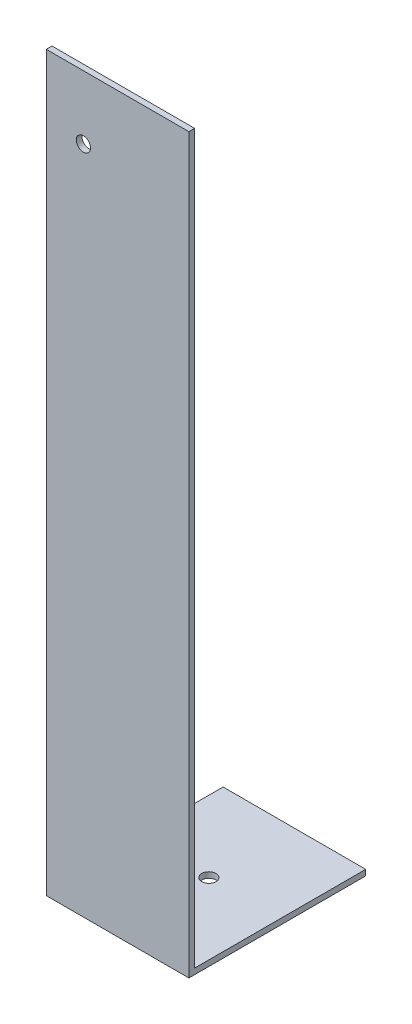
from build123d import *

# Parameters (mm, degrees)
SALIENTE_EXTRUIR1_DEPTH = 50
CROQUIS2_R              = 2.5
CORTAR_EXTRUIR1_DEPTH   = 10
CROQUIS3_R              = 2.5
CORTAR_EXTRUIR2_DEPTH   = 10


with BuildPart() as part:
    # Croquis1 → Saliente-Extruir1 (new body)
    with BuildSketch(Plane(origin=(0, 0, 0), x_dir=(0, 0, -1), z_dir=(1, 0, 0))):
        Polygon((-20.239694924, -215.034421421), (-20.239694924, 41.965578579), (-18.239694924, 41.965578579), (-18.239694924, -213.034421421), (41.760305076, -213.034421421), (41.760305076, -215.034421421), align=None)
    extrude(amount=SALIENTE_EXTRUIR1_DEPTH)

    # Croquis2 → Cortar-Extruir1 (cut)
    with BuildSketch(Plane(origin=(0, -213.034421421, 0), x_dir=(1, 0, 0), z_dir=(0, 1, 0))):
        with Locations(Location((25, 11.760305076, 0), (0, 0, 270))):
            Circle(CROQUIS2_R)
    extrude(amount=-CORTAR_EXTRUIR1_DEPTH, mode=Mode.SUBTRACT)

    # Croquis3 → Cortar-Extruir2 (cut)
    with BuildSketch(Plane(origin=(0, 0, 18.239694924), x_dir=(-1, 0, 0), z_dir=(0, 0, -1))):
        with Locations(Location((-13.01, 19.730578579, 0), (0, 0, 90))):
            Circle(CROQUIS3_R)
    extrude(amount=-CORTAR_EXTRUIR2_DEPTH, mode=Mode.SUBTRACT)


solid = part.part
